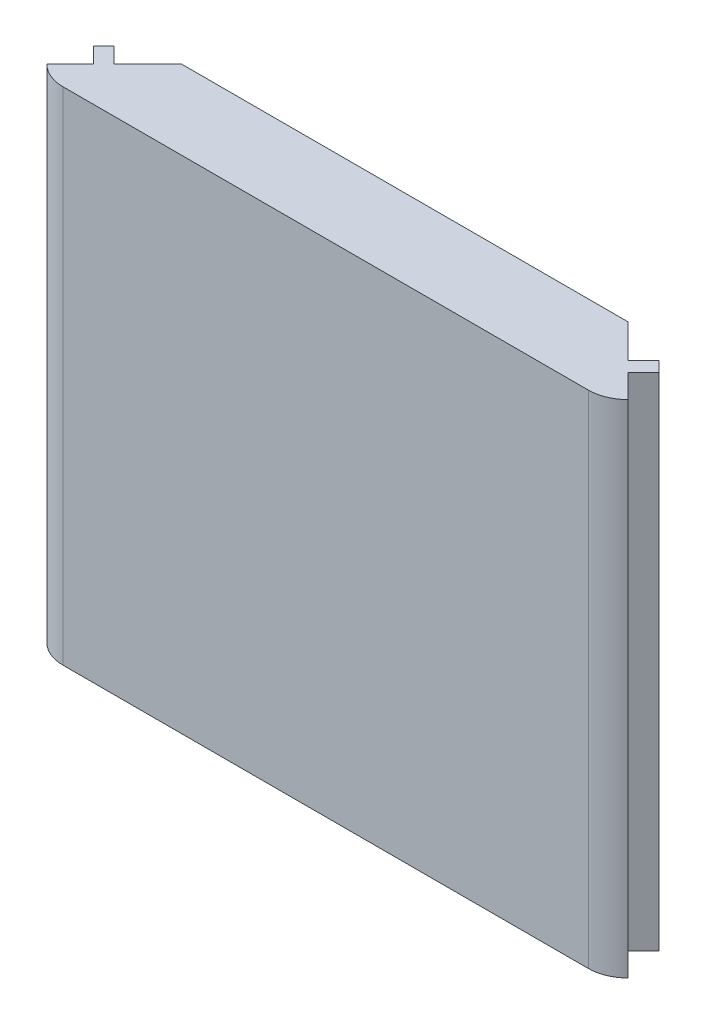
from build123d import *

# Parameters (mm, degrees)
SKETCH_1_W          = 81.9
SKETCH_1_H          = 67.9
EXTRUDE_1_DEPTH     = 10.7
SKETCH_2_W          = 60.5
SKETCH_2_H          = 60.5
CUT_EXTRUDE_1_DEPTH = 9.2
CUT_EXTRUDE_2_REACH = 82.011
CUT_EXTRUDE_4_REACH = 91.242
EXTRUDE_2_DEPTH     = 67.9


with BuildPart() as part:
    # Эскиз1 → Бобышка-Вытянуть1 (new body)
    with BuildSketch(Plane.XY):
        Rectangle(SKETCH_1_W, SKETCH_1_H)
    extrude(amount=-EXTRUDE_1_DEPTH)

    # Эскиз2 → Вырез-Вытянуть1 (cut)
    with BuildSketch(Plane(origin=(0, 0, -10.7), x_dir=(-1, 0, 0), z_dir=(0, 0, -1))):
        Rectangle(SKETCH_2_W, SKETCH_2_H)
    extrude(amount=-CUT_EXTRUDE_1_DEPTH, mode=Mode.SUBTRACT)

    # Эскиз3 → Вырез-Вытянуть2 (cut, up to next)
    with BuildSketch(Plane(origin=(0, 33.95, 0), x_dir=(1, 0, 0), z_dir=(0, 1, 0)), mode=Mode.PRIVATE) as cut_extrude_2_sk1:
        Polygon((-40.95, 0), (-30.25, 10.7), (-40.95, 10.7), align=None)
    cut_extrude_2_tool1 = extrude(cut_extrude_2_sk1.sketch, amount=-CUT_EXTRUDE_2_REACH, mode=Mode.PRIVATE) & part.part
    # Эскиз3 → Вырез-Вытянуть2 (cut, up to next)
    with BuildSketch(Plane(origin=(0, 33.95, 0), x_dir=(1, 0, 0), z_dir=(0, 1, 0)), mode=Mode.PRIVATE) as cut_extrude_2_sk2:
        Polygon((40.95, 10.7), (40.95, 0), (30.25, 10.7), align=None)
    cut_extrude_2_tool2 = extrude(cut_extrude_2_sk2.sketch, amount=-CUT_EXTRUDE_2_REACH, mode=Mode.PRIVATE) & part.part
    add(cut_extrude_2_tool1.solids().sort_by_distance((-37.383333, 33.95, -7.133333))[0], mode=Mode.SUBTRACT)
    add(cut_extrude_2_tool2.solids().sort_by_distance((37.383333, 33.95, -7.133333))[0], mode=Mode.SUBTRACT)

    # Эскиз4 → Вырез-Вытянуть4 (cut, up to next)
    with BuildSketch(Plane(origin=(0, -33.95, -40.95), x_dir=(1, 0, 0), z_dir=(0, 1, 0)), mode=Mode.PRIVATE) as cut_extrude_4_sk1:
        with BuildLine():
            Line((39.383021279, -39.383021279), (40.95, -40.95))
            Line((40.95, -40.95), (35.6, -40.95))
            ThreePointArc((35.6, -40.95), (37.647356363, -40.542755499), (39.383021279, -39.383021279))
        make_face()
    cut_extrude_4_tool1 = extrude(cut_extrude_4_sk1.sketch, amount=CUT_EXTRUDE_4_REACH, mode=Mode.PRIVATE) & part.part
    # Эскиз4 → Вырез-Вытянуть4 (cut, up to next)
    with BuildSketch(Plane(origin=(0, -33.95, -40.95), x_dir=(1, 0, 0), z_dir=(0, 1, 0)), mode=Mode.PRIVATE) as cut_extrude_4_sk2:
        with BuildLine():
            Line((-40.95, -40.95), (-35.6, -40.95))
            ThreePointArc((-35.6, -40.95), (-37.647356363, -40.542755499), (-39.383021279, -39.383021279))
            Line((-39.383021279, -39.383021279), (-40.95, -40.95))
        make_face()
    cut_extrude_4_tool2 = extrude(cut_extrude_4_sk2.sketch, amount=CUT_EXTRUDE_4_REACH, mode=Mode.PRIVATE) & part.part
    add(cut_extrude_4_tool1.solids().sort_by_distance((39.042099, -33.95, -0.482136))[0], mode=Mode.SUBTRACT)
    add(cut_extrude_4_tool2.solids().sort_by_distance((-39.042099, -33.95, -0.482136))[0], mode=Mode.SUBTRACT)

    # Эскиз7 → Бобышка-Вытянуть2 (add)
    with BuildSketch(Plane(origin=(0, 33.95, 0), x_dir=(1, 0, 0), z_dir=(0, 1, 0))):
        Polygon((-38.352044546, 6.840596142), (-36.937830983, 8.254809704), (-34.81651064, 6.13348936), (-36.230724202, 4.719275798), align=None)
        Polygon((36.937830983, 8.254809704), (34.81651064, 6.13348936), (36.230724202, 4.719275798), (38.352044546, 6.840596142), align=None)
    extrude(amount=-EXTRUDE_2_DEPTH)


solid = part.part
